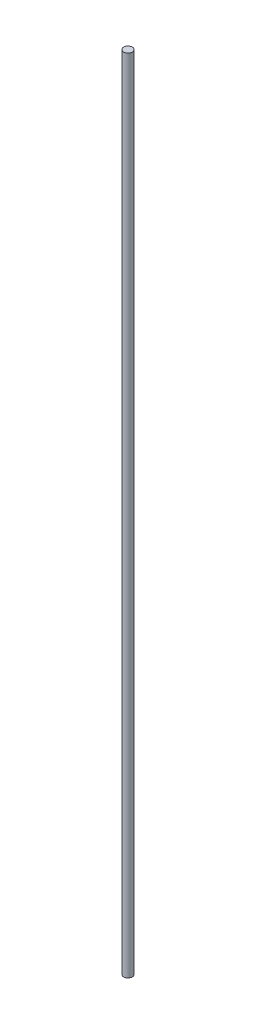
from build123d import *

# Parameters (mm, degrees)
SKETCH1_R           = 4
BOSS_EXTRUDE1_DEPTH = 740


with BuildPart() as part:
    # Sketch1 → Boss-Extrude1 (new body)
    with BuildSketch(Plane(origin=(0, 0, 0), x_dir=(1, 0, 0), z_dir=(0, 1, 0))):
        with Locations(Location((0, 0, 0), (0, 0, 270))):
            Circle(SKETCH1_R)
    extrude(amount=BOSS_EXTRUDE1_DEPTH)


solid = part.part
